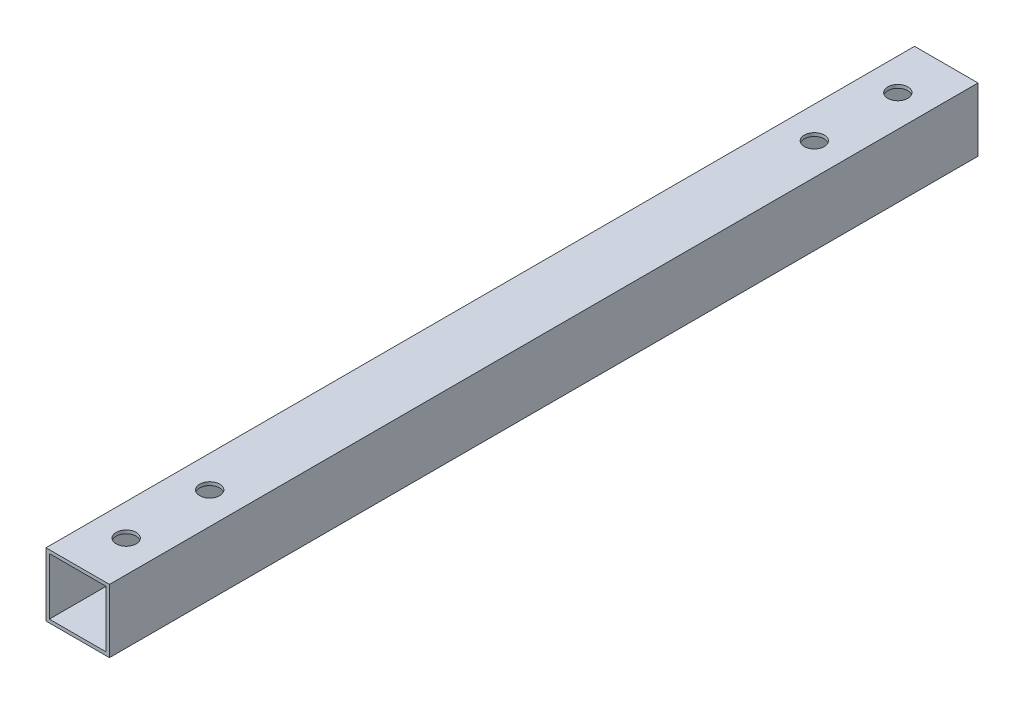
from build123d import *

# Parameters (mm, degrees)
ESBO_O1_W                = 19
ESBO_O1_H                = 19
RESSALTO_EXTRUS_O1_DEPTH = 260
CASCA2_T                 = -1
ESBO_O2_R                = 3
CORTE_EXTRUS_O1_DEPTH    = 261.866345089


with BuildPart() as part:
    # Esboço1 → Ressalto-extrusão1 (new body)
    with BuildSketch(Plane.XY):
        Rectangle(ESBO_O1_W, ESBO_O1_H)
    extrude(amount=RESSALTO_EXTRUS_O1_DEPTH)

    # Casca2
    casca2_openings = [part.faces().sort_by_distance(p)[0] for p in [
        (0, 0, 260),
        (0, 0, 0),
    ]]
    offset(amount=CASCA2_T, openings=casca2_openings, kind=Kind.INTERSECTION)

    # Esboço2 → Corte-extrusão1 (cut, through all)
    with BuildSketch(Plane(origin=(0, 9.5, 0), x_dir=(1, 0, 0), z_dir=(0, 1, 0))):
        with Locations(Location((0, -220.5, 0), (0, 0, 270))):
            Circle(ESBO_O2_R)
        with Locations(Location((0, -245.5, 0), (0, 0, 270))):
            Circle(ESBO_O2_R)
        with Locations(Location((0, -14.5, 0), (0, 0, 270))):
            Circle(ESBO_O2_R)
        with Locations(Location((0, -39.5, 0), (0, 0, 270))):
            Circle(ESBO_O2_R)
    extrude(amount=-CORTE_EXTRUS_O1_DEPTH, mode=Mode.SUBTRACT)


solid = part.part
